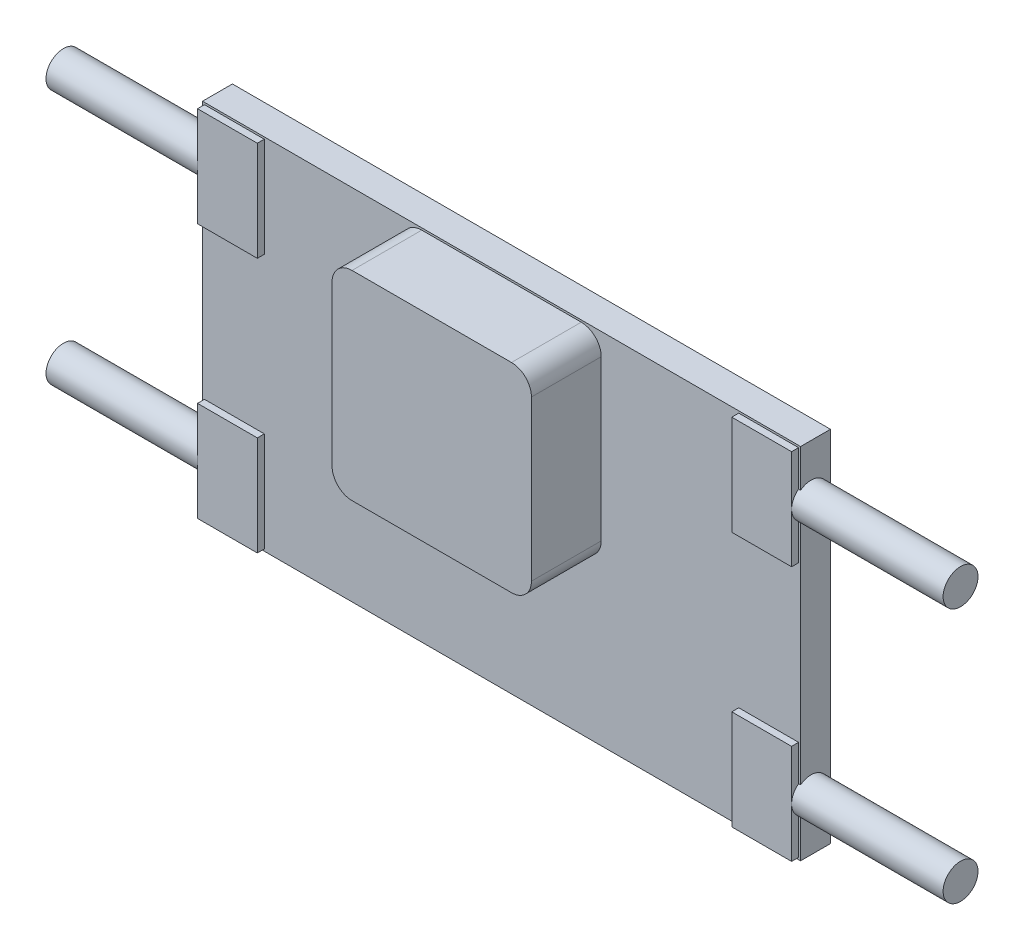
from build123d import *

# Parameters (mm, degrees)
SKETCH1_W                       = 30
SKETCH1_H                       = 18
BOSS_EXTRUDE1_DEPTH             = 1.5
BOSS_EXTRUDE2_DEPTH             = 3.5
SKETCH3_W                       = 3
SKETCH3_H                       = 5
BOSS_EXTRUDE3_DEPTH             = 0.35
SKETCH4_R                       = 0.875
BOSS_EXTRUDE4_DEPTH             = 7.5
BOSS_EXTRUDE4_DIRECTION_2_REACH = 33.718


with BuildPart() as part:
    # Sketch1 → Boss-Extrude1 (new body)
    with BuildSketch(Plane.XY):
        Rectangle(SKETCH1_W, SKETCH1_H)
    extrude(amount=BOSS_EXTRUDE1_DEPTH)

    # Sketch2 → Boss-Extrude2 (add)
    with BuildSketch(Plane.XY.offset(1.5)):
        with BuildLine():
            Line((-4, -1.1), (4, -1.1))
            ThreePointArc((4, -1.1), (4.707106781, -0.807106781), (5, -0.1))
            Line((5, -0.1), (5, 7.9))
            ThreePointArc((5, 7.9), (4.707106781, 8.607106781), (4, 8.9))
            Line((4, 8.9), (-4, 8.9))
            ThreePointArc((-4, 8.9), (-4.707106781, 8.607106781), (-5, 7.9))
            Line((-5, 7.9), (-5, -0.1))
            ThreePointArc((-5, -0.1), (-4.707106781, -0.807106781), (-4, -1.1))
        make_face()
    extrude(amount=BOSS_EXTRUDE2_DEPTH)

    # Sketch3 → Boss-Extrude3 (add)
    with BuildSketch(Plane.XY.offset(1.5)):
        with Locations((-13.4, 6.4)):
            Rectangle(SKETCH3_W, SKETCH3_H)
        with Locations((-13.4, -6.4)):
            Rectangle(SKETCH3_W, SKETCH3_H)
    boss_extrude3 = extrude(amount=BOSS_EXTRUDE3_DEPTH)

    # Sketch4 → Boss-Extrude4 (add)
    with BuildSketch(Plane.ZY.offset(15)):
        with Locations((0.975, 6.4)):
            Circle(SKETCH4_R)
        with Locations((0.975, -6.4)):
            Circle(SKETCH4_R)
    boss_extrude4 = extrude(amount=BOSS_EXTRUDE4_DEPTH)

    # Boss-Extrude4 direction 2: up to this face of the body (flat: up to its plane)
    boss_extrude4_direction_2_end = Plane(part.part.faces().sort_by_distance((-14.9, -6.4, 1.675))[0])
    # Sketch4 → Boss-Extrude4 direction 2 (add, up to the picked face)
    with BuildSketch(Plane.ZY.offset(15), mode=Mode.PRIVATE) as boss_extrude4_direction_2_sk1:
        with Locations((0.975, 6.4)):
            Circle(SKETCH4_R)
    boss_extrude4_direction_2_tool1 = split(extrude(boss_extrude4_direction_2_sk1.sketch, amount=-BOSS_EXTRUDE4_DIRECTION_2_REACH, mode=Mode.PRIVATE), bisect_by=boss_extrude4_direction_2_end, keep=Keep.BOTH, mode=Mode.PRIVATE)
    # Sketch4 → Boss-Extrude4 direction 2 (add, up to the picked face)
    with BuildSketch(Plane.ZY.offset(15), mode=Mode.PRIVATE) as boss_extrude4_direction_2_sk2:
        with Locations((0.975, -6.4)):
            Circle(SKETCH4_R)
    boss_extrude4_direction_2_tool2 = split(extrude(boss_extrude4_direction_2_sk2.sketch, amount=-BOSS_EXTRUDE4_DIRECTION_2_REACH, mode=Mode.PRIVATE), bisect_by=boss_extrude4_direction_2_end, keep=Keep.BOTH, mode=Mode.PRIVATE)
    boss_extrude4_direction_2_1 = boss_extrude4_direction_2_tool1.solids().sort_by(Axis((-15, 6.4, 0.975), (1, 0, 0)))[0]
    add(boss_extrude4_direction_2_1)
    boss_extrude4_direction_2_2 = boss_extrude4_direction_2_tool2.solids().sort_by(Axis((-15, -6.4, 0.975), (1, 0, 0)))[0]
    add(boss_extrude4_direction_2_2)
    boss_extrude4_direction_2 = boss_extrude4_direction_2_1 + boss_extrude4_direction_2_2  # Boss-Extrude4 direction 2 as one shape, for the pattern or mirror that repeats it

    # Mirror2: Boss-Extrude3, Boss-Extrude4, Boss-Extrude4 direction 2 across plane
    add(boss_extrude3.mirror(Plane(origin=(0, 0, 0), x_dir=(0, 0, 1), z_dir=(1, 0, 0))))
    add(boss_extrude4.mirror(Plane(origin=(0, 0, 0), x_dir=(0, 0, 1), z_dir=(1, 0, 0))))
    add(boss_extrude4_direction_2.mirror(Plane(origin=(0, 0, 0), x_dir=(0, 0, 1), z_dir=(1, 0, 0))))


solid = part.part
